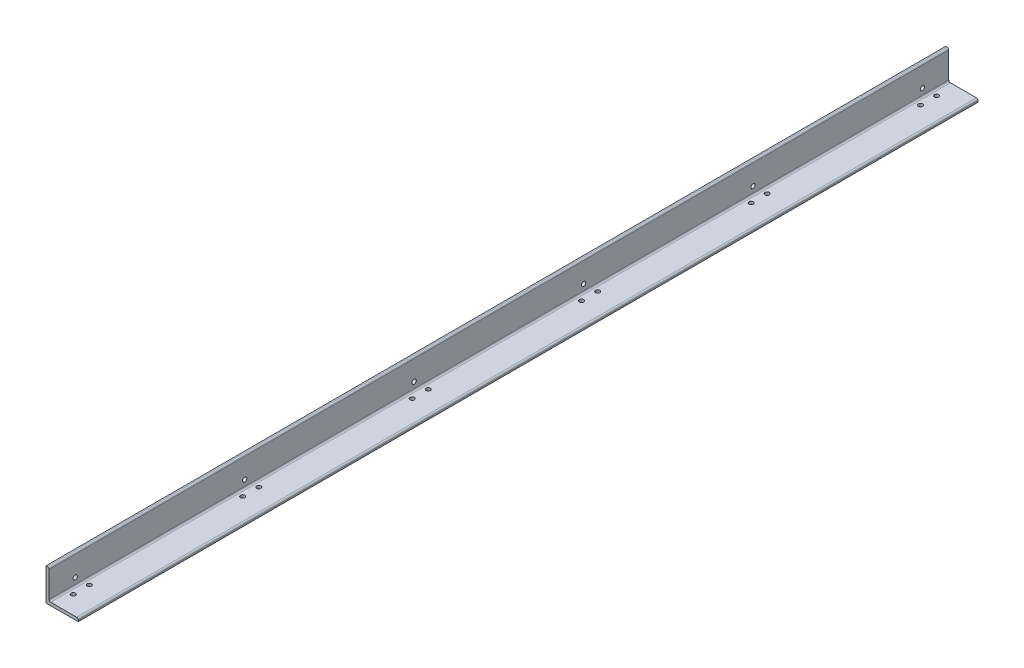
from build123d import *

# Parameters (mm, degrees)
BOSS_EXTRUDE1_DEPTH     = 708.025
FILLET1_R               = 2.54
F_1_4_CLEARANCE_HOLE1_D = 6.7564
LPATTERN1_COUNT         = 6
LPATTERN1_PITCH         = 266.7
F_1_4_CLEARANCE_HOLE4_D = 6.7564
LPATTERN4_COUNT         = 6
LPATTERN4_PITCH         = 266.7


with BuildPart() as part:
    # Sketch1 → Boss-Extrude1 (new, symmetric)
    with BuildSketch(Plane.XY):
        Polygon((0, 0), (0, 50.8), (4.7625, 50.8), (4.7625, 4.7625), (50.8, 4.7625), (50.8, 0), align=None)
    extrude(amount=BOSS_EXTRUDE1_DEPTH, both=True)

    # Fillet1
    fillet1_edges = [part.edges().sort_by_distance(p)[0] for p in [
        (4.7625, 50.8, 0),
        (4.7625, 4.7625, 0),
        (50.8, 4.7625, 0),
    ]]
    fillet(fillet1_edges, radius=FILLET1_R)

    # 1/4 Clearance Hole1 (through all)
    with Locations(Plane(origin=(0, 4.7625, 0), x_dir=(1, 0, 0), z_dir=(0, 1, 0))):
        with Locations((14.2875, -679.45), (14.2875, -654.05)):
            f_1_4_clearance_hole1 = Hole(F_1_4_CLEARANCE_HOLE1_D / 2)

    # LPattern1: 1/4 Clearance Hole1 ×6
    with Locations(*[(0, 0, -i * LPATTERN1_PITCH) for i in range(1, LPATTERN1_COUNT)]):
        add(f_1_4_clearance_hole1, mode=Mode.SUBTRACT)

    # 1/4 Clearance Hole4 (through all)
    with Locations(Plane.ZY):
        with Locations((-666.75, 16.66875)):
            f_1_4_clearance_hole4 = Hole(F_1_4_CLEARANCE_HOLE4_D / 2)

    # LPattern4: 1/4 Clearance Hole4 ×6
    with Locations(*[(0, 0, i * LPATTERN4_PITCH) for i in range(1, LPATTERN4_COUNT)]):
        add(f_1_4_clearance_hole4, mode=Mode.SUBTRACT)


solid = part.part
